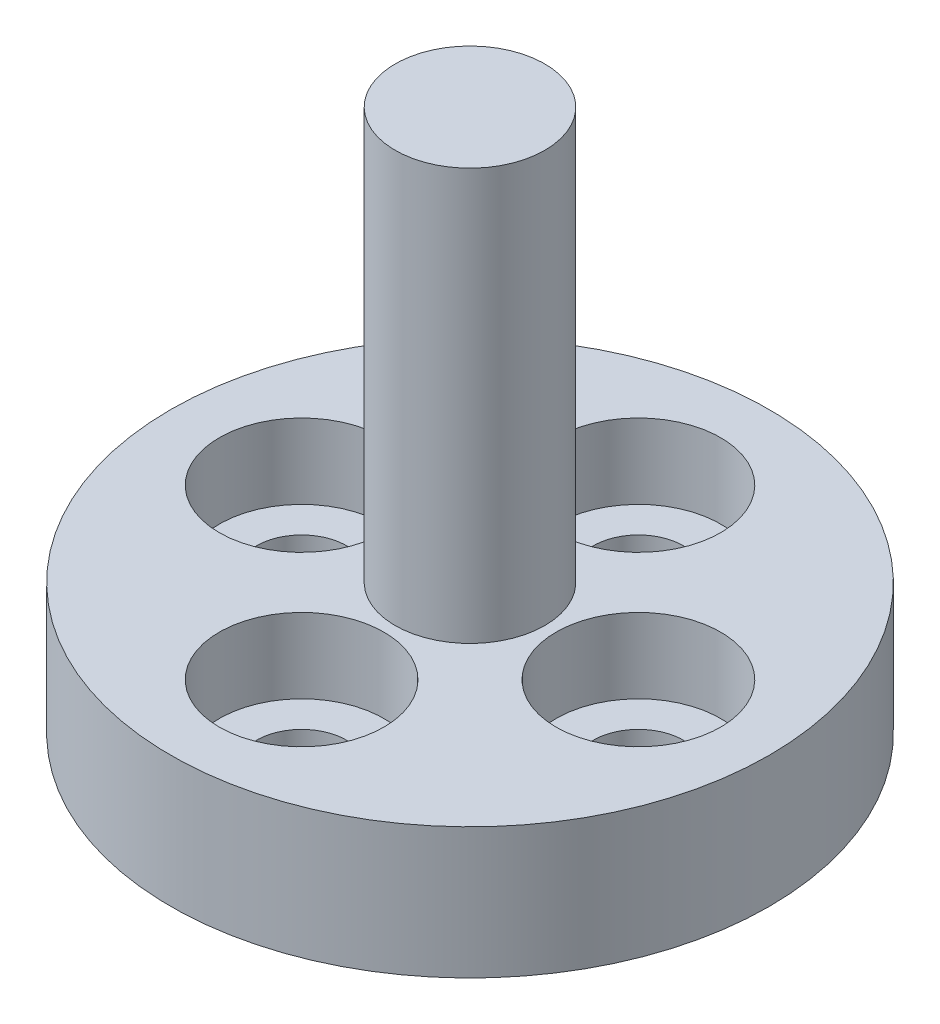
from build123d import *

# Parameters (mm, degrees)
CBORE_FOR_M2_SHCS2_D           = 2.4
CBORE_FOR_M2_SHCS2_CBORE_D     = 4.4
CBORE_FOR_M2_SHCS2_CBORE_DEPTH = 2


with BuildPart() as part:
    # Sketch1 → Revolve1 (revolve)
    with BuildSketch(Plane.XY):
        Polygon((-4, -7.25), (4, -7.25), (4, -3.75), (-2, -3.75), (-2, 7.25), (-4, 7.25), align=None)
    revolve(axis=Axis((-4, -7.25, 0), (0, 1, 0)))

    # CBORE for M2 SHCS2 (through all)
    with Locations(Plane(origin=(0, -3.75, 0), x_dir=(1, 0, 0), z_dir=(0, 1, 0))):
        with Locations((-4, 4.5), (0.5, 0), (-4, -4.5), (-8.5, 0)):
            CounterBoreHole(CBORE_FOR_M2_SHCS2_D / 2, CBORE_FOR_M2_SHCS2_CBORE_D / 2, CBORE_FOR_M2_SHCS2_CBORE_DEPTH)


solid = part.part
